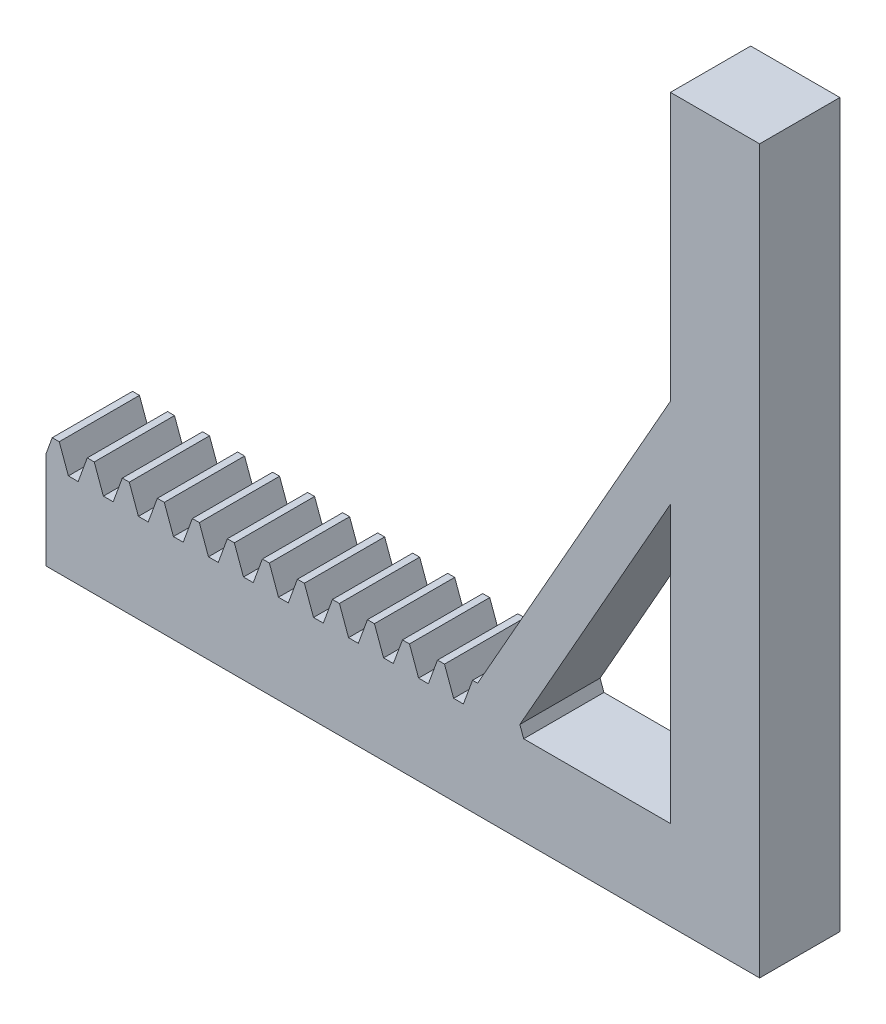
from build123d import *

# Parameters (mm, degrees)
BOSS_EXTRUDE1_DEPTH      = 9
CUT_EXTRUDE3_START       = -75
SKETCH4_W                = 9
SKETCH4_H                = 12.8125
CUT_EXTRUDE3_DEPTH       = 426.134035175
BOSS_EXTRUDE2_DEPTH      = 5
BOSS_EXTRUDE2_DEPTH_BACK = 5
SKETCH5_W                = 9
SKETCH5_H                = 81
BOSS_EXTRUDE3_DEPTH      = 9
CUT_EXTRUDE4_DEPTH       = 10


with BuildPart() as part:
    # Sketch1 → Boss-Extrude1 (new body)
    with BuildSketch(Plane(origin=(0, 0, -3.69297844), x_dir=(-1, 0, 0), z_dir=(0, 0, -1))):
        Polygon((-247.145212992, 2.522278293), (-248.168879276, -0.290221707), (-249.2649677, -0.290221707), (-249.9890903, 1.699288787), (-249.9890903, -10.290221707), (250.0109097, -10.290221707), (250.0109097, -0.290221707), (249.462865488, -0.290221707), (248.439199204, 2.522278293), (247.655629383, 2.522278293), (246.631963099, -0.290221707), (245.535874675, -0.290221707), (244.512208391, 2.522278293), (243.728638571, 2.522278293), (242.704972287, -0.290221707), (241.608883863, -0.290221707), (240.585217579, 2.522278293), (239.801647758, 2.522278293), (238.777981474, -0.290221707), (237.68189305, -0.290221707), (236.658226766, 2.522278293), (235.874656946, 2.522278293), (234.850990662, -0.290221707), (233.754902238, -0.290221707), (232.731235954, 2.522278293), (231.947666133, 2.522278293), (230.923999849, -0.290221707), (229.827911425, -0.290221707), (228.804245141, 2.522278293), (228.020675321, 2.522278293), (226.997009037, -0.290221707), (225.900920613, -0.290221707), (224.877254329, 2.522278293), (224.093684508, 2.522278293), (223.070018224, -0.290221707), (221.9739298, -0.290221707), (220.950263516, 2.522278293), (220.166693696, 2.522278293), (219.143027412, -0.290221707), (218.046938988, -0.290221707), (217.023272704, 2.522278293), (216.239702883, 2.522278293), (215.216036599, -0.290221707), (214.119948175, -0.290221707), (213.096281891, 2.522278293), (212.312712071, 2.522278293), (211.289045787, -0.290221707), (210.192957363, -0.290221707), (209.169291079, 2.522278293), (208.385721258, 2.522278293), (207.362054974, -0.290221707), (206.26596655, -0.290221707), (205.242300266, 2.522278293), (204.458730446, 2.522278293), (203.435064162, -0.290221707), (202.338975738, -0.290221707), (201.315309454, 2.522278293), (200.531739633, 2.522278293), (199.508073349, -0.290221707), (198.411984925, -0.290221707), (197.388318641, 2.522278293), (196.604748821, 2.522278293), (195.581082537, -0.290221707), (194.484994113, -0.290221707), (193.461327829, 2.522278293), (192.677758008, 2.522278293), (191.654091724, -0.290221707), (190.5580033, -0.290221707), (189.534337016, 2.522278293), (188.750767196, 2.522278293), (187.727100912, -0.290221707), (186.631012488, -0.290221707), (185.607346204, 2.522278293), (184.823776383, 2.522278293), (183.800110099, -0.290221707), (182.704021675, -0.290221707), (181.680355391, 2.522278293), (180.896785571, 2.522278293), (179.873119287, -0.290221707), (178.777030863, -0.290221707), (177.753364579, 2.522278293), (176.969794758, 2.522278293), (175.946128474, -0.290221707), (174.85004005, -0.290221707), (173.826373766, 2.522278293), (173.042803946, 2.522278293), (172.019137662, -0.290221707), (170.923049238, -0.290221707), (169.899382954, 2.522278293), (169.115813133, 2.522278293), (168.092146849, -0.290221707), (166.996058425, -0.290221707), (165.972392141, 2.522278293), (165.188822321, 2.522278293), (164.165156037, -0.290221707), (163.069067613, -0.290221707), (162.045401329, 2.522278293), (161.261831508, 2.522278293), (160.238165224, -0.290221707), (159.1420768, -0.290221707), (158.118410516, 2.522278293), (157.334840696, 2.522278293), (156.311174412, -0.290221707), (155.215085988, -0.290221707), (154.191419704, 2.522278293), (153.407849883, 2.522278293), (152.384183599, -0.290221707), (151.288095175, -0.290221707), (150.264428891, 2.522278293), (149.480859071, 2.522278293), (148.457192787, -0.290221707), (147.361104363, -0.290221707), (146.337438079, 2.522278293), (145.553868258, 2.522278293), (144.530201974, -0.290221707), (143.43411355, -0.290221707), (142.410447266, 2.522278293), (141.626877446, 2.522278293), (140.603211162, -0.290221707), (139.507122738, -0.290221707), (138.483456454, 2.522278293), (137.699886633, 2.522278293), (136.676220349, -0.290221707), (135.580131925, -0.290221707), (134.556465641, 2.522278293), (133.772895821, 2.522278293), (132.749229537, -0.290221707), (131.653141113, -0.290221707), (130.629474829, 2.522278293), (129.845905008, 2.522278293), (128.822238724, -0.290221707), (127.7261503, -0.290221707), (126.702484016, 2.522278293), (125.918914196, 2.522278293), (124.895247912, -0.290221707), (123.799159488, -0.290221707), (122.775493204, 2.522278293), (121.991923383, 2.522278293), (120.968257099, -0.290221707), (119.872168675, -0.290221707), (118.848502391, 2.522278293), (118.064932571, 2.522278293), (117.041266287, -0.290221707), (115.945177863, -0.290221707), (114.921511579, 2.522278293), (114.137941758, 2.522278293), (113.114275474, -0.290221707), (112.01818705, -0.290221707), (110.994520766, 2.522278293), (110.210950946, 2.522278293), (109.187284662, -0.290221707), (108.091196238, -0.290221707), (107.067529954, 2.522278293), (106.283960133, 2.522278293), (105.260293849, -0.290221707), (104.164205425, -0.290221707), (103.140539141, 2.522278293), (102.356969321, 2.522278293), (101.333303037, -0.290221707), (100.237214613, -0.290221707), (99.213548329, 2.522278293), (98.429978508, 2.522278293), (97.406312224, -0.290221707), (96.3102238, -0.290221707), (95.286557516, 2.522278293), (94.502987696, 2.522278293), (93.479321412, -0.290221707), (92.383232988, -0.290221707), (91.359566704, 2.522278293), (90.575996883, 2.522278293), (89.552330599, -0.290221707), (88.456242175, -0.290221707), (87.432575891, 2.522278293), (86.649006071, 2.522278293), (85.625339787, -0.290221707), (84.529251363, -0.290221707), (83.505585079, 2.522278293), (82.722015258, 2.522278293), (81.698348974, -0.290221707), (80.60226055, -0.290221707), (79.578594266, 2.522278293), (78.795024446, 2.522278293), (77.771358162, -0.290221707), (76.675269738, -0.290221707), (75.651603454, 2.522278293), (74.868033633, 2.522278293), (73.844367349, -0.290221707), (72.748278925, -0.290221707), (71.724612641, 2.522278293), (70.941042821, 2.522278293), (69.917376537, -0.290221707), (68.821288113, -0.290221707), (67.797621829, 2.522278293), (67.014052008, 2.522278293), (65.990385724, -0.290221707), (64.8942973, -0.290221707), (63.870631016, 2.522278293), (63.087061196, 2.522278293), (62.063394912, -0.290221707), (60.967306488, -0.290221707), (59.943640204, 2.522278293), (59.160070383, 2.522278293), (58.136404099, -0.290221707), (57.040315675, -0.290221707), (56.016649391, 2.522278293), (55.233079571, 2.522278293), (54.209413287, -0.290221707), (53.113324863, -0.290221707), (52.089658579, 2.522278293), (51.306088758, 2.522278293), (50.282422474, -0.290221707), (49.18633405, -0.290221707), (48.162667766, 2.522278293), (47.379097946, 2.522278293), (46.355431662, -0.290221707), (45.259343238, -0.290221707), (44.235676954, 2.522278293), (43.452107133, 2.522278293), (42.428440849, -0.290221707), (41.332352425, -0.290221707), (40.308686141, 2.522278293), (39.525116321, 2.522278293), (38.501450037, -0.290221707), (37.405361613, -0.290221707), (36.381695329, 2.522278293), (35.598125508, 2.522278293), (34.574459224, -0.290221707), (33.4783708, -0.290221707), (32.454704516, 2.522278293), (31.671134696, 2.522278293), (30.647468412, -0.290221707), (29.551379988, -0.290221707), (28.527713704, 2.522278293), (27.744143883, 2.522278293), (26.720477599, -0.290221707), (25.624389175, -0.290221707), (24.600722891, 2.522278293), (23.817153071, 2.522278293), (22.793486787, -0.290221707), (21.697398363, -0.290221707), (20.673732079, 2.522278293), (19.890162258, 2.522278293), (18.866495974, -0.290221707), (17.77040755, -0.290221707), (16.746741266, 2.522278293), (15.963171446, 2.522278293), (14.939505162, -0.290221707), (13.843416738, -0.290221707), (12.819750454, 2.522278293), (12.036180633, 2.522278293), (11.012514349, -0.290221707), (9.916425925, -0.290221707), (8.892759641, 2.522278293), (8.109189821, 2.522278293), (7.085523537, -0.290221707), (5.989435113, -0.290221707), (4.965768829, 2.522278293), (4.182199008, 2.522278293), (3.158532724, -0.290221707), (2.0624443, -0.290221707), (1.038778016, 2.522278293), (0.255208196, 2.522278293), (-0.768458088, -0.290221707), (-1.864546512, -0.290221707), (-2.888212796, 2.522278293), (-3.671782617, 2.522278293), (-4.695448901, -0.290221707), (-5.791537325, -0.290221707), (-6.815203609, 2.522278293), (-7.598773429, 2.522278293), (-8.622439713, -0.290221707), (-9.718528137, -0.290221707), (-10.742194421, 2.522278293), (-11.525764242, 2.522278293), (-12.549430526, -0.290221707), (-13.64551895, -0.290221707), (-14.669185234, 2.522278293), (-15.452755054, 2.522278293), (-16.476421338, -0.290221707), (-17.572509762, -0.290221707), (-18.596176046, 2.522278293), (-19.379745867, 2.522278293), (-20.403412151, -0.290221707), (-21.499500575, -0.290221707), (-22.523166859, 2.522278293), (-23.306736679, 2.522278293), (-24.330402963, -0.290221707), (-25.426491387, -0.290221707), (-26.450157671, 2.522278293), (-27.233727492, 2.522278293), (-28.257393776, -0.290221707), (-29.3534822, -0.290221707), (-30.377148484, 2.522278293), (-31.160718304, 2.522278293), (-32.184384588, -0.290221707), (-33.280473012, -0.290221707), (-34.304139296, 2.522278293), (-35.087709117, 2.522278293), (-36.111375401, -0.290221707), (-37.207463825, -0.290221707), (-38.231130109, 2.522278293), (-39.014699929, 2.522278293), (-40.038366213, -0.290221707), (-41.134454637, -0.290221707), (-42.158120921, 2.522278293), (-42.941690742, 2.522278293), (-43.965357026, -0.290221707), (-45.06144545, -0.290221707), (-46.085111734, 2.522278293), (-46.868681554, 2.522278293), (-47.892347838, -0.290221707), (-48.988436262, -0.290221707), (-50.012102546, 2.522278293), (-50.795672367, 2.522278293), (-51.819338651, -0.290221707), (-52.915427075, -0.290221707), (-53.939093359, 2.522278293), (-54.722663179, 2.522278293), (-55.746329463, -0.290221707), (-56.842417887, -0.290221707), (-57.866084171, 2.522278293), (-58.649653992, 2.522278293), (-59.673320276, -0.290221707), (-60.7694087, -0.290221707), (-61.793074984, 2.522278293), (-62.576644804, 2.522278293), (-63.600311088, -0.290221707), (-64.696399512, -0.290221707), (-65.720065796, 2.522278293), (-66.503635617, 2.522278293), (-67.527301901, -0.290221707), (-68.623390325, -0.290221707), (-69.647056609, 2.522278293), (-70.430626429, 2.522278293), (-71.454292713, -0.290221707), (-72.550381137, -0.290221707), (-73.574047421, 2.522278293), (-74.357617242, 2.522278293), (-75.381283526, -0.290221707), (-76.47737195, -0.290221707), (-77.501038234, 2.522278293), (-78.284608054, 2.522278293), (-79.308274338, -0.290221707), (-80.404362762, -0.290221707), (-81.428029046, 2.522278293), (-82.211598867, 2.522278293), (-83.235265151, -0.290221707), (-84.331353575, -0.290221707), (-85.355019859, 2.522278293), (-86.138589679, 2.522278293), (-87.162255963, -0.290221707), (-88.258344387, -0.290221707), (-89.282010671, 2.522278293), (-90.065580492, 2.522278293), (-91.089246776, -0.290221707), (-92.1853352, -0.290221707), (-93.209001484, 2.522278293), (-93.992571304, 2.522278293), (-95.016237588, -0.290221707), (-96.112326012, -0.290221707), (-97.135992296, 2.522278293), (-97.919562117, 2.522278293), (-98.943228401, -0.290221707), (-100.039316825, -0.290221707), (-101.062983109, 2.522278293), (-101.846552929, 2.522278293), (-102.870219213, -0.290221707), (-103.966307637, -0.290221707), (-104.989973921, 2.522278293), (-105.773543742, 2.522278293), (-106.797210026, -0.290221707), (-107.89329845, -0.290221707), (-108.916964734, 2.522278293), (-109.700534554, 2.522278293), (-110.724200838, -0.290221707), (-111.820289262, -0.290221707), (-112.843955546, 2.522278293), (-113.627525367, 2.522278293), (-114.651191651, -0.290221707), (-115.747280075, -0.290221707), (-116.770946359, 2.522278293), (-117.554516179, 2.522278293), (-118.578182463, -0.290221707), (-119.674270887, -0.290221707), (-120.697937171, 2.522278293), (-121.481506992, 2.522278293), (-122.505173276, -0.290221707), (-123.6012617, -0.290221707), (-124.624927984, 2.522278293), (-125.408497804, 2.522278293), (-126.432164088, -0.290221707), (-127.528252512, -0.290221707), (-128.551918796, 2.522278293), (-129.335488617, 2.522278293), (-130.359154901, -0.290221707), (-131.455243325, -0.290221707), (-132.478909609, 2.522278293), (-133.262479429, 2.522278293), (-134.286145713, -0.290221707), (-135.382234137, -0.290221707), (-136.405900421, 2.522278293), (-137.189470242, 2.522278293), (-138.213136526, -0.290221707), (-139.30922495, -0.290221707), (-140.332891234, 2.522278293), (-141.116461054, 2.522278293), (-142.140127338, -0.290221707), (-143.236215762, -0.290221707), (-144.259882046, 2.522278293), (-145.043451867, 2.522278293), (-146.067118151, -0.290221707), (-147.163206575, -0.290221707), (-148.186872859, 2.522278293), (-148.970442679, 2.522278293), (-149.994108963, -0.290221707), (-151.090197387, -0.290221707), (-152.113863671, 2.522278293), (-152.897433492, 2.522278293), (-153.921099776, -0.290221707), (-155.0171882, -0.290221707), (-156.040854484, 2.522278293), (-156.824424304, 2.522278293), (-157.848090588, -0.290221707), (-158.944179012, -0.290221707), (-159.967845296, 2.522278293), (-160.751415117, 2.522278293), (-161.775081401, -0.290221707), (-162.871169825, -0.290221707), (-163.894836109, 2.522278293), (-164.678405929, 2.522278293), (-165.702072213, -0.290221707), (-166.798160637, -0.290221707), (-167.821826921, 2.522278293), (-168.605396742, 2.522278293), (-169.629063026, -0.290221707), (-170.72515145, -0.290221707), (-171.748817734, 2.522278293), (-172.532387554, 2.522278293), (-173.556053838, -0.290221707), (-174.652142262, -0.290221707), (-175.675808546, 2.522278293), (-176.459378367, 2.522278293), (-177.483044651, -0.290221707), (-178.579133075, -0.290221707), (-179.602799359, 2.522278293), (-180.386369179, 2.522278293), (-181.410035463, -0.290221707), (-182.506123887, -0.290221707), (-183.529790171, 2.522278293), (-184.313359992, 2.522278293), (-185.337026276, -0.290221707), (-186.4331147, -0.290221707), (-187.456780984, 2.522278293), (-188.240350804, 2.522278293), (-189.264017088, -0.290221707), (-190.360105512, -0.290221707), (-191.383771796, 2.522278293), (-192.167341617, 2.522278293), (-193.191007901, -0.290221707), (-194.287096325, -0.290221707), (-195.310762609, 2.522278293), (-196.094332429, 2.522278293), (-197.117998713, -0.290221707), (-198.214087137, -0.290221707), (-199.237753421, 2.522278293), (-200.021323242, 2.522278293), (-201.044989526, -0.290221707), (-202.14107795, -0.290221707), (-203.164744234, 2.522278293), (-203.948314054, 2.522278293), (-204.971980338, -0.290221707), (-206.068068762, -0.290221707), (-207.091735046, 2.522278293), (-207.875304867, 2.522278293), (-208.898971151, -0.290221707), (-209.995059575, -0.290221707), (-211.018725859, 2.522278293), (-211.802295679, 2.522278293), (-212.825961963, -0.290221707), (-213.922050387, -0.290221707), (-214.945716671, 2.522278293), (-215.729286492, 2.522278293), (-216.752952776, -0.290221707), (-217.8490412, -0.290221707), (-218.872707484, 2.522278293), (-219.656277304, 2.522278293), (-220.679943588, -0.290221707), (-221.776032012, -0.290221707), (-222.799698296, 2.522278293), (-223.583268117, 2.522278293), (-224.606934401, -0.290221707), (-225.703022825, -0.290221707), (-226.726689109, 2.522278293), (-227.510258929, 2.522278293), (-228.533925213, -0.290221707), (-229.630013637, -0.290221707), (-230.653679921, 2.522278293), (-231.437249742, 2.522278293), (-232.460916026, -0.290221707), (-233.55700445, -0.290221707), (-234.580670734, 2.522278293), (-235.364240554, 2.522278293), (-236.387906838, -0.290221707), (-237.483995262, -0.290221707), (-238.507661546, 2.522278293), (-239.291231367, 2.522278293), (-240.314897651, -0.290221707), (-241.410986075, -0.290221707), (-242.434652359, 2.522278293), (-243.218222179, 2.522278293), (-244.241888463, -0.290221707), (-245.337976887, -0.290221707), (-246.361643171, 2.522278293), align=None)
    extrude(amount=-BOSS_EXTRUDE1_DEPTH)

    # Sketch4 → Cut-Extrude3 (cut, through all)
    with BuildSketch(Plane(origin=(249.9890903, 0, 0), x_dir=(0, 0, -1), z_dir=(1, 0, 0)).offset(CUT_EXTRUDE3_START)):
        with Locations((-0.80702156, -3.883971707)):
            Rectangle(SKETCH4_W, SKETCH4_H)
    extrude(amount=-CUT_EXTRUDE3_DEPTH, mode=Mode.SUBTRACT)

    # Sketch5 → Boss-Extrude2 (add, two sides: drawn at the far end of the back side and taken through both)
    with BuildSketch(Plane(origin=(249.9890903, 0, 0), x_dir=(0, 0, -1), z_dir=(1, 0, 0)).offset(-BOSS_EXTRUDE2_DEPTH_BACK)):
        with Locations((-0.80702156, 30.209778293)):
            Rectangle(SKETCH5_W, SKETCH5_H)
    extrude(amount=BOSS_EXTRUDE2_DEPTH + BOSS_EXTRUDE2_DEPTH_BACK)

    # Sketch6 → Boss-Extrude3 (add)
    with BuildSketch(Plane(origin=(0, 0, -3.69297844), x_dir=(-1, 0, 0), z_dir=(0, 0, -1))):
        Polygon((-221.776032012, -0.290221707), (-244.9890903, 40.709778293), (-244.9890903, 30.709778293), (-226.296912319, -2.305229368), align=None)
    extrude(amount=-BOSS_EXTRUDE3_DEPTH)

    # Sketch7 → Cut-Extrude4 (cut)
    with BuildSketch(Plane(origin=(0, 0, -3.69297844), x_dir=(-1, 0, 0), z_dir=(0, 0, -1))):
        Polygon((-230.653679921, 2.522278293), (-229.630013637, -0.290221707), (-230.653679921, -0.290221707), (-244.9890903, -0.290221707), (-244.9890903, 2.522278293), align=None)
    extrude(amount=-CUT_EXTRUDE4_DEPTH, mode=Mode.SUBTRACT)


solid = part.part
